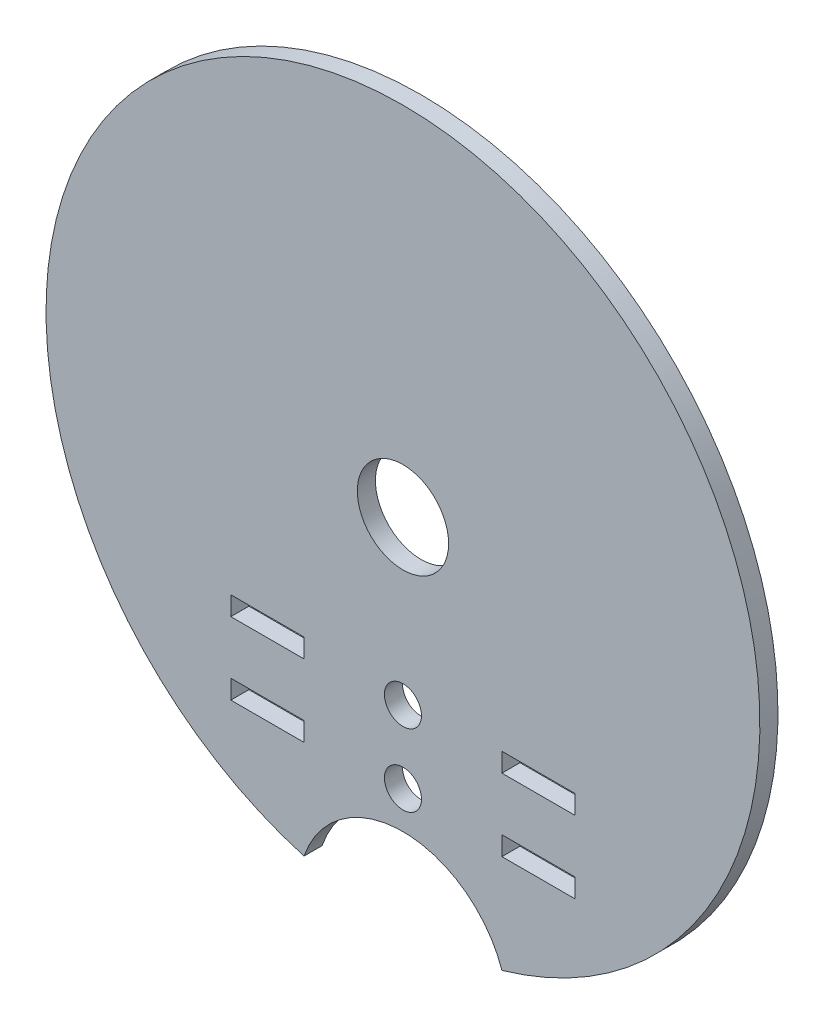
from build123d import *

# Parameters (mm, degrees)
SKETCH_1_R      = 2.05
SKETCH_1_R_2    = 5.05
SKETCH_1_W      = 8.1
SKETCH_1_H      = 2.1
EXTRUDE_1_DEPTH = 2


with BuildPart() as part:
    # 草图1 → 凸台-拉伸1 (new body)
    with BuildSketch(Plane.XY):
        with BuildLine():
            ThreePointArc((-10.95, -11.95191036), (0, -4.124206955), (10.95, -11.95191036))
            ThreePointArc((10.95, -11.95191036), (0, 65.5), (-10.95, -11.95191036))
        make_face()
        Circle(SKETCH_1_R, mode=Mode.SUBTRACT)
        with Locations((0, 8)):
            Circle(SKETCH_1_R, mode=Mode.SUBTRACT)
        with Locations((0, 26)):
            Circle(SKETCH_1_R_2, mode=Mode.SUBTRACT)
        with Locations((-15, 8)):
            Rectangle(SKETCH_1_W, SKETCH_1_H, mode=Mode.SUBTRACT)
        with Locations((-15, 0)):
            Rectangle(SKETCH_1_W, SKETCH_1_H, mode=Mode.SUBTRACT)
        with Locations((15, 8)):
            Rectangle(SKETCH_1_W, SKETCH_1_H, mode=Mode.SUBTRACT)
        with Locations((15, 0)):
            Rectangle(SKETCH_1_W, SKETCH_1_H, mode=Mode.SUBTRACT)
    extrude(amount=EXTRUDE_1_DEPTH)


solid = part.part
